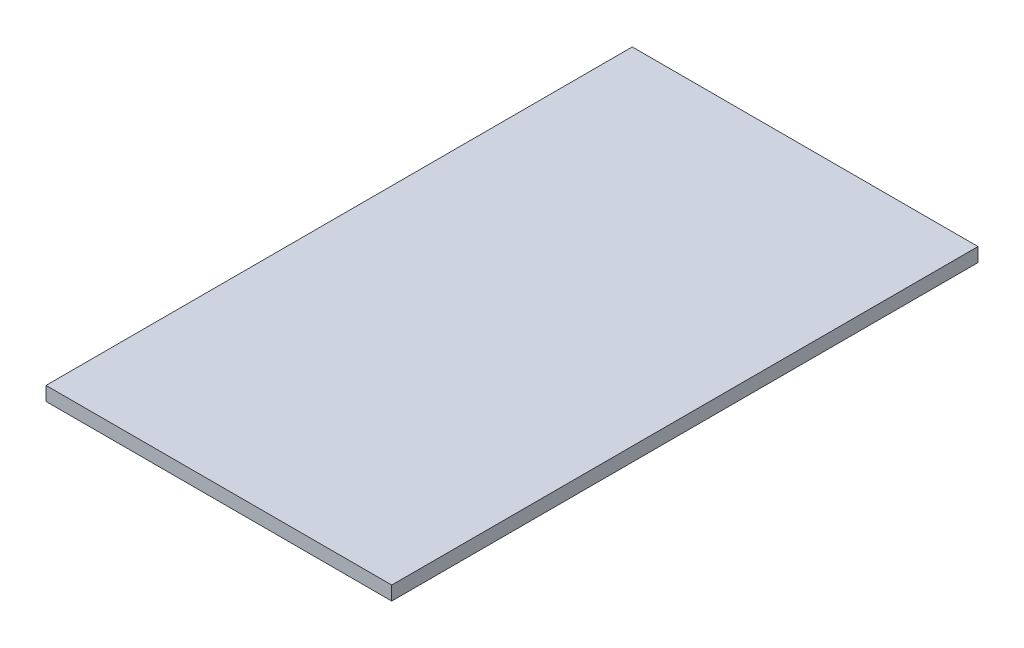
from build123d import *

# Parameters (mm, degrees)
SKETCH1_W      = 157.734
SKETCH1_H      = 267.462
EXTRUDE1_DEPTH = 6.35


with BuildPart() as part:
    # Sketch1 → Extrude1 (new body)
    with BuildSketch(Plane(origin=(0, 0, 0), x_dir=(1, 0, 0), z_dir=(0, 1, 0))):
        with Locations((103.196630383, 133.731)):
            Rectangle(SKETCH1_W, SKETCH1_H)
    extrude(amount=EXTRUDE1_DEPTH)


solid = part.part
